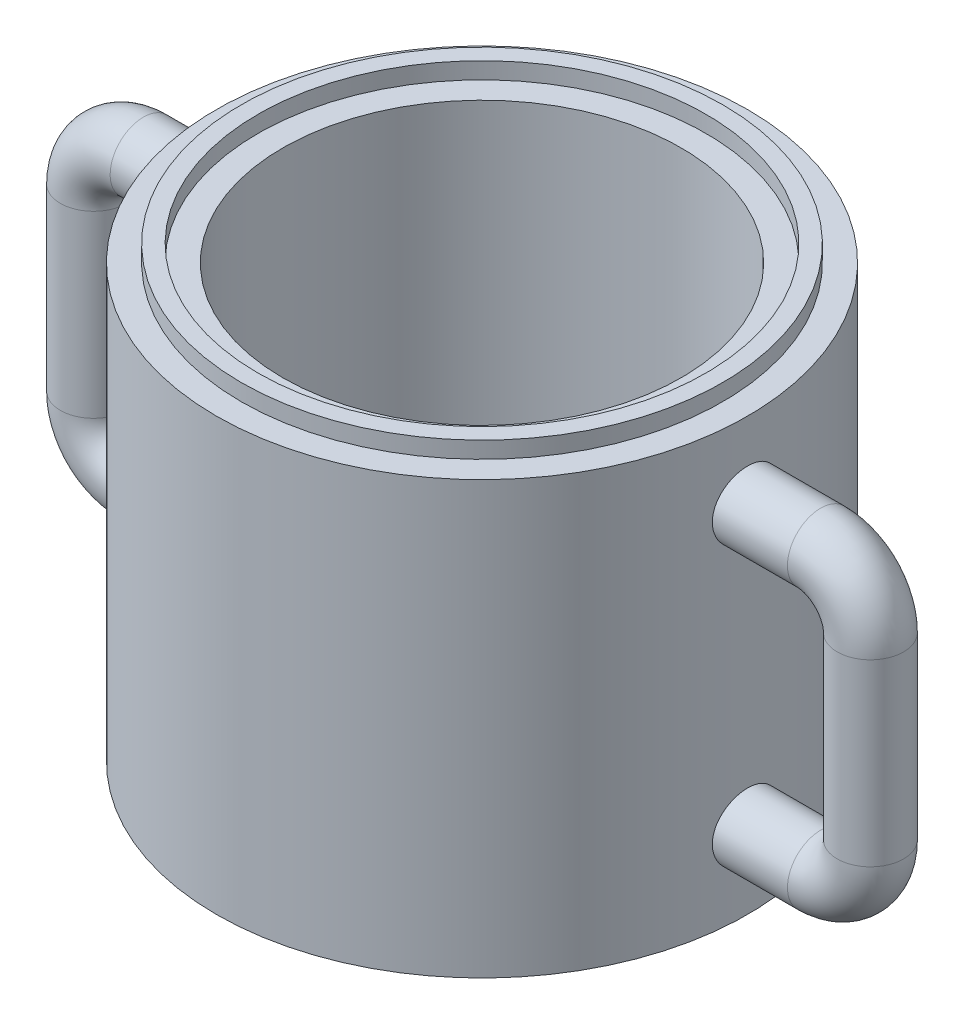
from build123d import *

# Parameters (mm, degrees)
ESBO_O1_R                = 80
RESSALTO_EXTRUS_O1_DEPTH = 130
ESBO_O2_R                = 60
CORTE_EXTRUS_O1_DEPTH    = 100
ESBO_O4_W                = 5
ESBO_O4_H                = 5
VARREDURA2_PROFILE_R     = 10
VARREDURA3_PROFILE_R     = 10


with BuildPart() as part:
    # Esboço1 → Ressalto-extrusão1 (new body)
    with BuildSketch(Plane(origin=(0, 0, 0), x_dir=(1, 0, 0), z_dir=(0, 1, 0))):
        with Locations(Location((0, 0, 0), (0, 0, 270))):
            Circle(ESBO_O1_R)
    extrude(amount=RESSALTO_EXTRUS_O1_DEPTH)

    # Esboço2 → Corte-extrusão1 (cut)
    with BuildSketch(Plane(origin=(0, 130, 0), x_dir=(1, 0, 0), z_dir=(0, 1, 0))):
        with Locations(Location((0, 0, 0), (0, 0, 270))):
            Circle(ESBO_O2_R)
    extrude(amount=-CORTE_EXTRUS_O1_DEPTH, mode=Mode.SUBTRACT)

    # Esboço4 → Revolução1 (revolve)
    with BuildSketch(Plane(origin=(0, 0, 0), x_dir=(0, 0, -1), z_dir=(1, 0, 0))):
        with Locations((-70, 132.5)):
            Rectangle(ESBO_O4_W, ESBO_O4_H)
    revolve(axis=Axis((0, 130, 0), (0, -1, 0)))

    # Varredura2: sweep along a path in Esboço6
    with BuildLine(Plane.XY) as varredura2_path:
        Line((70, 107), (102, 107))
        ThreePointArc((102, 107), (112.606601718, 102.606601718), (117, 92))
        Line((117, 92), (117, 38))
        ThreePointArc((117, 38), (112.606601718, 27.393398282), (102, 23))
        Line((102, 23), (70, 23))
    # Varredura2 profile (on start of the path) → Varredura2 (sweep)
    with BuildSketch(Plane(origin=(70, 107, 0), x_dir=(0, 0, 1), z_dir=(1, 0, 0))):
        Circle(VARREDURA2_PROFILE_R)
    sweep(path=varredura2_path.line)

    # Varredura3: sweep along a path in Esboço36
    with BuildLine(Plane.XY) as varredura3_path:
        Line((-70, 107), (-102, 107))
        ThreePointArc((-102, 107), (-112.606601718, 102.606601718), (-117, 92))
        Line((-117, 92), (-117, 38))
        ThreePointArc((-117, 38), (-112.606601718, 27.393398282), (-102, 23))
        Line((-102, 23), (-70, 23))
    # Varredura3 profile (on start of the path) → Varredura3 (sweep)
    with BuildSketch(Plane(origin=(-70, 107, 0), x_dir=(0, 0, -1), z_dir=(-1, 0, 0))):
        Circle(VARREDURA3_PROFILE_R)
    sweep(path=varredura3_path.line)


solid = part.part
